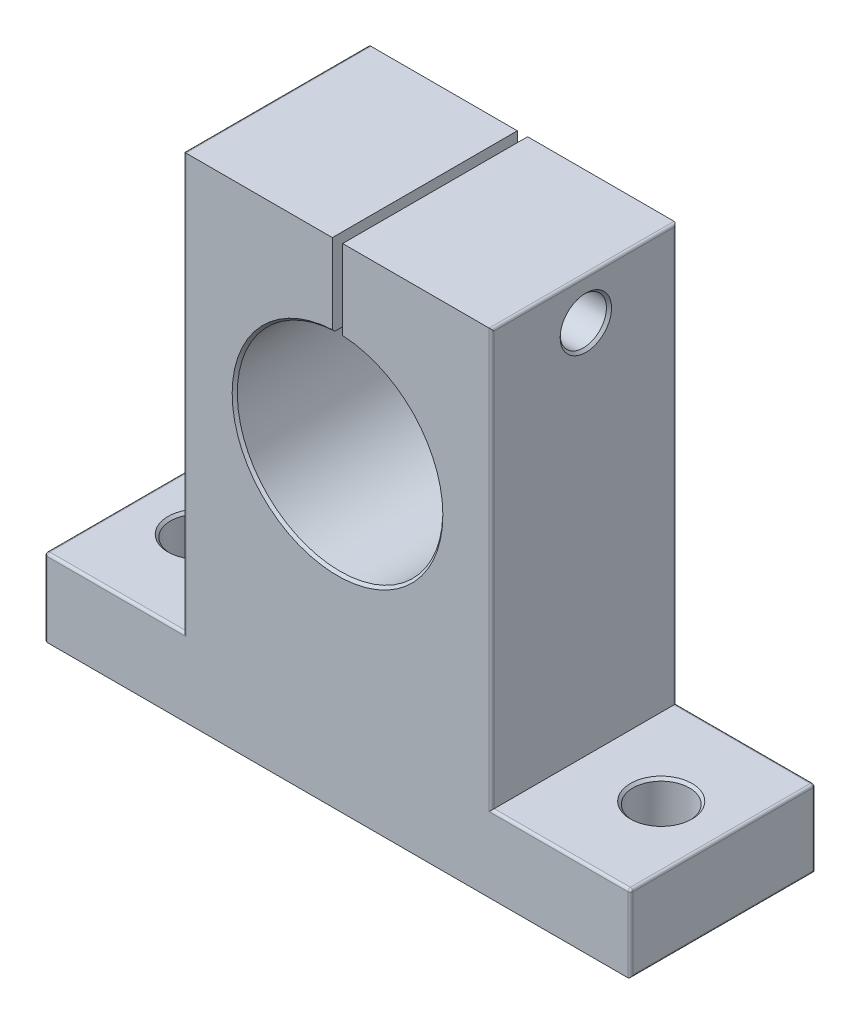
from build123d import *

# Parameters (mm, degrees)
BOSS_EXTRUDE1_DEPTH     = 18
SKETCH2_R               = 5.5
CUT_EXTRUDE1_DEPTH      = 101.667770413
CUT_EXTRUDE2_DEPTH      = 108.332427532
CUT_EXTRUDE2_DEPTH_BACK = 108.332427532
SKETCH5_R               = 4.5
CHAMFER2_SIZE           = 0.5
FILLET2_R               = 0.5


with BuildPart() as part:
    # Sketch1 → Boss-Extrude1 (new, symmetric)
    with BuildSketch(Plane.XY):
        with BuildLine():
            Line((-57, -7.5), (-57, 7.5))
            Line((-57, 7.5), (-30, 7.5))
            Line((-30, 7.5), (-30, 88.5))
            Line((-30, 88.5), (-1, 88.5))
            Line((-1, 88.5), (-1, 72.474984355))
            ThreePointArc((-1, 72.474984355), (0, 32.5), (1, 72.474984355))
            Line((1, 72.474984355), (1, 88.5))
            Line((1, 88.5), (30, 88.5))
            Line((30, 88.5), (30, 7.5))
            Line((30, 7.5), (57, 7.5))
            Line((57, 7.5), (57, -7.5))
            Line((57, -7.5), (-57, -7.5))
        make_face()
    extrude(amount=BOSS_EXTRUDE1_DEPTH, both=True)

    # Sketch2 → Cut-Extrude1 (cut, through all)
    with BuildSketch(Plane(origin=(0, 7.5, 0), x_dir=(1, 0, 0), z_dir=(0, 1, 0))):
        with Locations(Location((45, 0, 0), (0, 0, 180))):
            Circle(SKETCH2_R)
        with Locations((-45, 0)):
            Circle(SKETCH2_R)
    extrude(amount=-CUT_EXTRUDE1_DEPTH, mode=Mode.SUBTRACT)

    # Sketch5 → Cut-Extrude2 (cut, two sides: drawn at the far end of the back side and taken through both)
    with BuildSketch(Plane(origin=(-1, 0, 0), x_dir=(0, 0, -1), z_dir=(1, 0, 0)).offset(-CUT_EXTRUDE2_DEPTH_BACK)):
        with Locations((0.330734984, 80.487492178)):
            Circle(SKETCH5_R)
    extrude(amount=CUT_EXTRUDE2_DEPTH + CUT_EXTRUDE2_DEPTH_BACK, mode=Mode.SUBTRACT)

    # Chamfer2
    chamfer2_edges = [part.edges().sort_by_distance(p)[0] for p in [
        (0, 32.5, -18),
        (0, 32.5, 18),
        (50.5, 7.5, 0),
        (-50.5, 7.5, 0),
        (-30, 80.487492178, 4.169265016),
        (30, 80.487492178, 4.169265016),
    ]]
    chamfer(chamfer2_edges, length=CHAMFER2_SIZE)

    # Fillet2
    fillet2_edges = [part.edges().sort_by_distance(p)[0] for p in [
        (-43.5, 7.5, 18),
        (30, 48, -18),
        (43.5, 7.5, -18),
        (-57, 0, 18),
        (57, 0, -18),
        (-57, 0, -18),
        (-43.5, 7.5, -18),
        (-30, 48, -18),
        (57, 0, 18),
        (30, 88.5, 0),
        (57, 7.5, 0),
        (57, -7.5, 0),
        (-57, -7.5, 0),
        (-57, 7.5, 0),
        (-30, 88.5, 0),
        (43.5, 7.5, 18),
        (30, 48, 18),
        (-30, 48, 18),
    ]]
    fillet(fillet2_edges, radius=FILLET2_R)


solid = part.part
